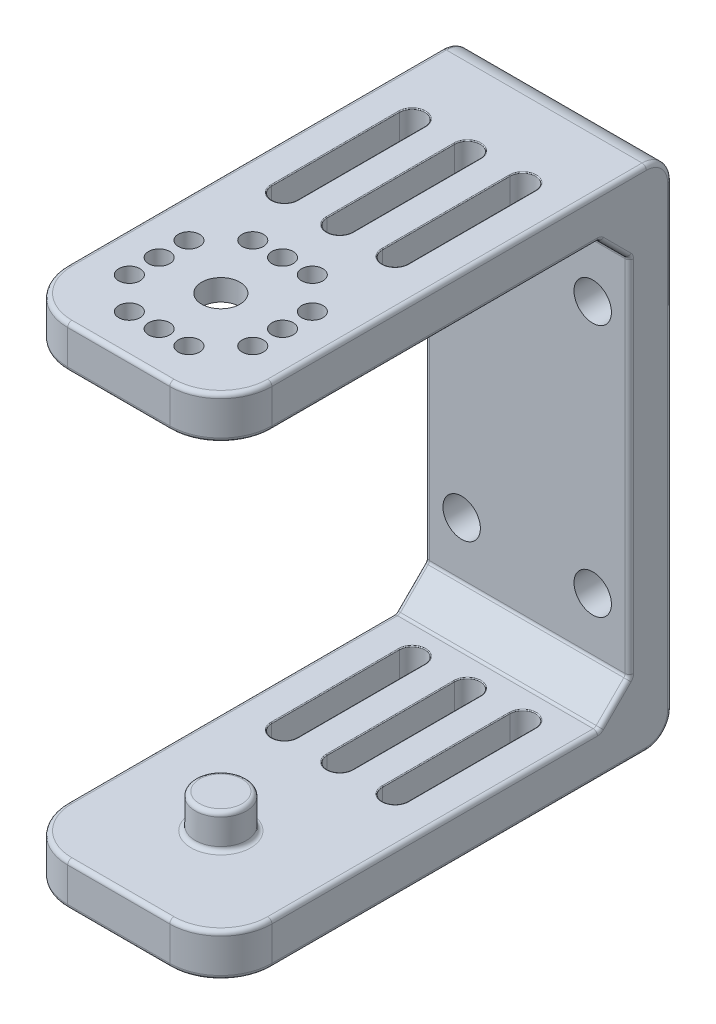
from build123d import *

# Parameters (mm, degrees)
BOSS_EXTRUDE1_DEPTH = 24
SKETCH2_R           = 10.5
CUT_EXTRUDE1_DEPTH  = 2.5
SKETCH4_R           = 2.25
SKETCH4_R_2         = 1.25
CUT_EXTRUDE2_DEPTH  = 10
FILLET2_R           = 6
FILLET3_R           = 3
SKETCH7_R           = 2.2
CUT_EXTRUDE3_DEPTH  = 7
SKETCH8_R           = 3
BOSS_EXTRUDE2_DEPTH = 4
FILLET4_R           = 0.5
CUT_EXTRUDE4_DEPTH  = 65
FILLET5_R           = 0.1


with BuildPart() as part:
    # Sketch1 → Boss-Extrude1 (new body)
    with BuildSketch(Plane(origin=(0, 0, 0), x_dir=(0, 0, -1), z_dir=(1, 0, 0))):
        Polygon((0, 59.7), (0, 0), (-53, 0), (-53, 5), (-8.535533906, 5), (-5, 8.535533906), (-5, 51.164466094), (-8.535533906, 54.7), (-53, 54.7), (-53, 59.7), align=None)
    extrude(amount=BOSS_EXTRUDE1_DEPTH)

    # Sketch2 → Cut-Extrude1 (cut)
    with BuildSketch(Plane.XZ.offset(-54.7)):
        with Locations(Location((12, 41, 0), (0, 0, 270))):
            Circle(SKETCH2_R)
    extrude(amount=-CUT_EXTRUDE1_DEPTH, mode=Mode.SUBTRACT)

    # Sketch4 → Cut-Extrude2 (cut)
    with BuildSketch(Plane.XZ.offset(-57.2)):
        with Locations(Location((12, 41, 0), (0, 0, 270))):
            Circle(SKETCH4_R)
        with Locations(Location((12, 48.25, 0), (0, 0, 270))):
            Circle(SKETCH4_R_2)
        with Locations(Location((8.5, 48.25, 0), (0, 0, 270))):
            Circle(SKETCH4_R_2)
        with Locations(Location((15.5, 48.25, 0), (0, 0, 270))):
            Circle(SKETCH4_R_2)
        with Locations(Location((19.25, 44.5, 0), (0, 0, 270))):
            Circle(SKETCH4_R_2)
        with Locations(Location((19.25, 41, 0), (0, 0, 270))):
            Circle(SKETCH4_R_2)
        with Locations(Location((19.25, 37.5, 0), (0, 0, 270))):
            Circle(SKETCH4_R_2)
        with Locations(Location((15.5, 33.75, 0), (0, 0, 270))):
            Circle(SKETCH4_R_2)
        with Locations(Location((12, 33.75, 0), (0, 0, 270))):
            Circle(SKETCH4_R_2)
        with Locations(Location((8.5, 33.75, 0), (0, 0, 270))):
            Circle(SKETCH4_R_2)
        with Locations(Location((4.75, 37.5, 0), (0, 0, 270))):
            Circle(SKETCH4_R_2)
        with Locations(Location((4.75, 41, 0), (0, 0, 270))):
            Circle(SKETCH4_R_2)
        with Locations(Location((4.75, 44.5, 0), (0, 0, 270))):
            Circle(SKETCH4_R_2)
    extrude(amount=-CUT_EXTRUDE2_DEPTH, mode=Mode.SUBTRACT)

    # Fillet2
    fillet2_edges = [part.edges().sort_by_distance(p)[0] for p in [
        (0, 2.5, 53),
        (0, 57.2, 53),
        (24, 2.5, 53),
        (24, 57.2, 53),
    ]]
    fillet(fillet2_edges, radius=FILLET2_R)

    # Fillet3
    fillet3_edges = [part.edges().sort_by_distance(p)[0] for p in [
        (12, 59.7, 0),
        (12, 0, 0),
    ]]
    fillet(fillet3_edges, radius=FILLET3_R)

    # Sketch7 → Cut-Extrude3 (cut)
    with BuildSketch(Plane(origin=(0, 0, 0), x_dir=(-1, 0, 0), z_dir=(0, 0, -1))):
        with Locations(Location((-19.7, 44.7, 0), (0, 0, 90))):
            Circle(SKETCH7_R)
        with Locations(Location((-19.7, 15, 0), (0, 0, 90))):
            Circle(SKETCH7_R)
        with Locations(Location((-4.3, 15, 0), (0, 0, 90))):
            Circle(SKETCH7_R)
        with Locations(Location((-4.3, 44.7, 0), (0, 0, 90))):
            Circle(SKETCH7_R)
    extrude(amount=-CUT_EXTRUDE3_DEPTH, mode=Mode.SUBTRACT)

    # Sketch8 → Boss-Extrude2 (add)
    with BuildSketch(Plane(origin=(0, 5, 0), x_dir=(1, 0, 0), z_dir=(0, 1, 0))):
        with Locations(Location((12, -41, 0), (0, 0, 90))):
            Circle(SKETCH8_R)
    extrude(amount=BOSS_EXTRUDE2_DEPTH)

    # Fillet4
    fillet4_edges = [part.edges().sort_by_distance(p)[0] for p in [
        (24, 54.7, 27.767766953),
        (24, 0, 25),
        (0, 0, 25),
        (12, 0, 53),
        (1.757359313, 0, 51.242640687),
        (22.242640687, 0, 51.242640687),
        (12, 5, 53),
        (1.757359313, 5, 51.242640687),
        (22.242640687, 5, 51.242640687),
        (0, 54.7, 27.767766953),
        (12, 54.7, 53),
        (1.757359313, 54.7, 51.242640687),
        (22.242640687, 54.7, 51.242640687),
        (12, 59.7, 53),
        (1.757359313, 59.7, 51.242640687),
        (0, 5, 27.767766953),
        (22.242640687, 59.7, 51.242640687),
        (0, 6.767766953, 6.767766953),
        (0, 29.85, 5),
        (0, 52.932233047, 6.767766953),
        (0, 29.85, 0),
        (24, 29.85, 0),
        (0, 59.7, 25),
        (0, 58.821320344, 0.878679656),
        (0, 0.878679656, 0.878679656),
        (24, 59.7, 25),
        (24, 58.821320344, 0.878679656),
        (24, 0.878679656, 0.878679656),
        (12, 5, 44),
        (12, 9, 44),
        (24, 52.932233047, 6.767766953),
        (12, 5, 8.535533906),
        (12, 8.535533906, 5),
        (12, 51.164466094, 5),
        (12, 54.7, 8.535533906),
        (24, 29.85, 5),
        (24, 6.767766953, 6.767766953),
        (24, 5, 27.767766953),
    ]]
    fillet(fillet4_edges, radius=FILLET4_R)

    # Sketch9 → Cut-Extrude4 (cut, symmetric)
    with BuildSketch(Plane.XZ.offset(-54.7)):
        with BuildLine():
            Line((10.5, 12.017766953), (10.5, 27.017766953))
            ThreePointArc((10.5, 27.017766953), (12, 28.517766953), (13.5, 27.017766953))
            Line((13.5, 27.017766953), (13.5, 12.017766953))
            ThreePointArc((13.5, 12.017766953), (12, 10.517766953), (10.5, 12.017766953))
        make_face()
        with BuildLine():
            Line((20, 12.017766953), (20, 27.017766953))
            ThreePointArc((20, 27.017766953), (18.5, 28.517766953), (17, 27.017766953))
            Line((17, 27.017766953), (17, 12.017766953))
            ThreePointArc((17, 12.017766953), (18.5, 10.517766953), (20, 12.017766953))
        make_face()
        with BuildLine():
            Line((7, 12.017766953), (7, 27.017766953))
            ThreePointArc((7, 27.017766953), (5.5, 28.517766953), (4, 27.017766953))
            Line((4, 27.017766953), (4, 12.017766953))
            ThreePointArc((4, 12.017766953), (5.5, 10.517766953), (7, 12.017766953))
        make_face()
    extrude(amount=CUT_EXTRUDE4_DEPTH, both=True, mode=Mode.SUBTRACT)

    # Fillet5
    fillet5_edges = [part.edges().sort_by_distance(p)[0] for p in [
        (10.5, 0, 19.517766953),
        (12, 0, 10.517766953),
        (13.5, 0, 19.517766953),
        (12, 0, 28.517766953),
        (7, 0, 19.517766953),
        (5.5, 0, 28.517766953),
        (4, 0, 19.517766953),
        (5.5, 0, 10.517766953),
        (17, 0, 19.517766953),
        (18.5, 0, 10.517766953),
        (20, 0, 19.517766953),
        (18.5, 0, 28.517766953),
        (18.5, 59.7, 28.517766953),
        (18.5, 54.7, 28.517766953),
        (18.5, 5, 28.517766953),
        (20, 59.7, 19.517766953),
        (20, 54.7, 19.517766953),
        (20, 5, 19.517766953),
        (18.5, 59.7, 10.517766953),
        (18.5, 54.7, 10.517766953),
        (18.5, 5, 10.517766953),
        (17, 59.7, 19.517766953),
        (17, 54.7, 19.517766953),
        (17, 5, 19.517766953),
        (5.5, 59.7, 10.517766953),
        (5.5, 54.7, 10.517766953),
        (5.5, 5, 10.517766953),
        (4, 59.7, 19.517766953),
        (4, 54.7, 19.517766953),
        (4, 5, 19.517766953),
        (5.5, 59.7, 28.517766953),
        (5.5, 54.7, 28.517766953),
        (5.5, 5, 28.517766953),
        (7, 59.7, 19.517766953),
        (7, 54.7, 19.517766953),
        (7, 5, 19.517766953),
        (12, 59.7, 28.517766953),
        (12, 54.7, 28.517766953),
        (12, 5, 28.517766953),
        (13.5, 59.7, 19.517766953),
        (13.5, 54.7, 19.517766953),
        (13.5, 5, 19.517766953),
        (12, 59.7, 10.517766953),
        (12, 54.7, 10.517766953),
        (12, 5, 10.517766953),
        (10.5, 59.7, 19.517766953),
        (10.5, 54.7, 19.517766953),
        (10.5, 5, 19.517766953),
    ]]
    fillet(fillet5_edges, radius=FILLET5_R)


solid = part.part
